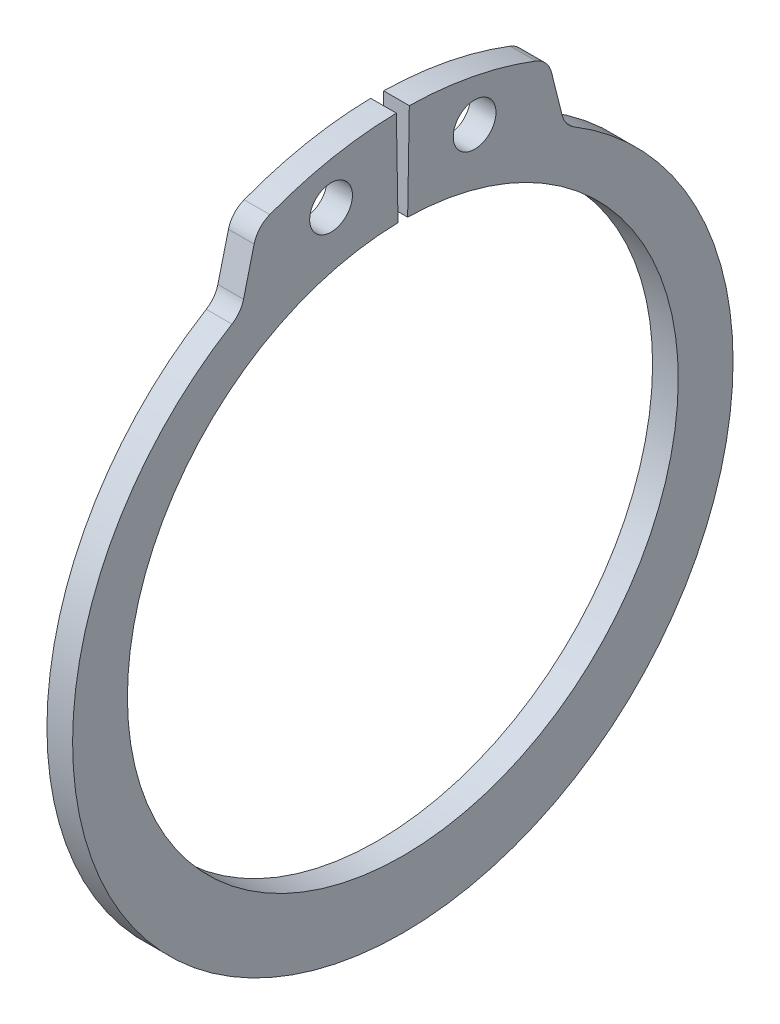
from build123d import *

# Parameters (mm, degrees)
SKETCH1_R      = 1.25
EXTRUDE1_DEPTH = 0.75
FILLET1_R      = 1.5


with BuildPart() as part:
    # Sketch1 → Extrude1 (new, symmetric)
    with BuildSketch(Plane(origin=(0, 0, 0), x_dir=(0, 0, -1), z_dir=(1, 0, 0))):
        with BuildLine():
            Line((-0.280983744, 16.097547892), (-0.37871722, 21.696694985))
            ThreePointArc((-0.37871722, 21.696694985), (-4.52737031, 21.222462583), (-8.508382933, 19.962400153))
            Line((-8.508382933, 19.962400153), (-9.464382452, 16.128095511))
            ThreePointArc((-9.464382452, 16.128095511), (0, -20), (9.464382452, 16.128095511))
            Line((9.464382452, 16.128095511), (8.508382933, 19.962400153))
            ThreePointArc((8.508382933, 19.962400153), (4.52737031, 21.222462583), (0.37871722, 21.696694985))
            Line((0.37871722, 21.696694985), (0.280983744, 16.097547892))
            ThreePointArc((0.280983744, 16.097547892), (0, -16.1), (-0.280983744, 16.097547892))
        make_face()
        with Locations((-4.19530179, 18.829649735)):
            Circle(SKETCH1_R, mode=Mode.SUBTRACT)
        with Locations((4.19530179, 18.829649735)):
            Circle(SKETCH1_R, mode=Mode.SUBTRACT)
    extrude(amount=EXTRUDE1_DEPTH, both=True)

    # Fillet1
    fillet1_edges = [part.edges().sort_by_distance(p)[0] for p in [
        (0, 19.962400153, -8.508382933),
        (0, 16.128095511, -9.464382452),
        (0, 16.128095511, 9.464382452),
        (0, 19.962400153, 8.508382933),
    ]]
    fillet(fillet1_edges, radius=FILLET1_R)


solid = part.part
